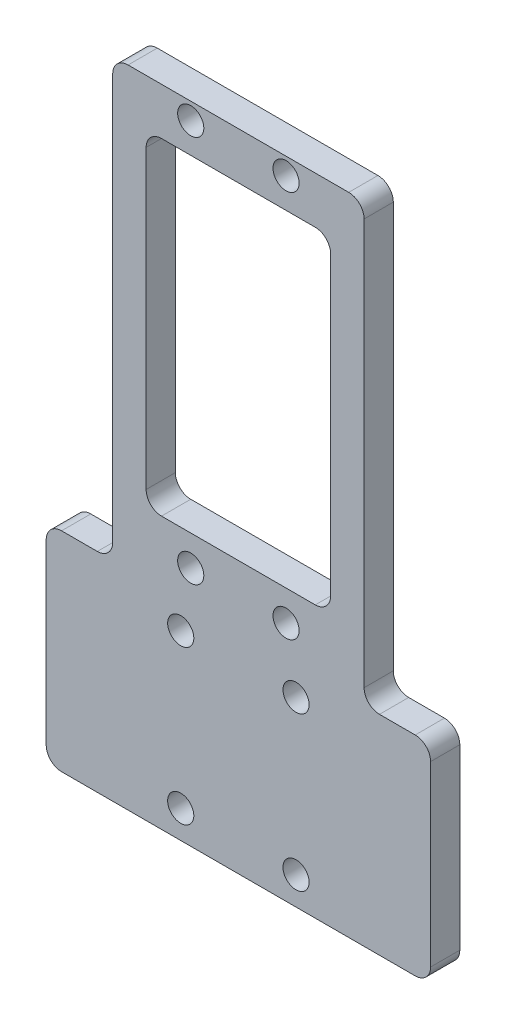
from build123d import *

# Parameters (mm, degrees)
SKETCH1_R           = 1.7
BOSS_EXTRUDE1_DEPTH = 3.8


with BuildPart() as part:
    # Sketch1 → Boss-Extrude1 (new body)
    with BuildSketch(Plane.XY):
        with BuildLine():
            Line((3.000019473, 70.3), (31.700019473, 70.3))
            ThreePointArc((31.700019473, 70.3), (33.114233035, 69.714213562), (33.700019473, 68.3))
            Line((33.700019473, 68.3), (33.700019473, 15.5))
            ThreePointArc((33.700019473, 15.5), (34.285805911, 14.085786438), (35.700019473, 13.5))
            Line((35.700019473, 13.5), (40.350019473, 13.5))
            ThreePointArc((40.350019473, 13.5), (41.764233035, 12.914213562), (42.350019473, 11.5))
            Line((42.350019473, 11.5), (42.350019473, -11.641128199))
            ThreePointArc((42.350019473, -11.641128199), (41.764233035, -13.055341761), (40.350019473, -13.641128199))
            Line((40.350019473, -13.641128199), (31.700019473, -13.641128199))
            Line((31.700019473, -13.641128199), (3.000019473, -13.641128199))
            Line((3.000019473, -13.641128199), (-5.649980527, -13.641128199))
            ThreePointArc((-5.649980527, -13.641128199), (-7.064194089, -13.055341761), (-7.649980527, -11.641128199))
            Line((-7.649980527, -11.641128199), (-7.649980527, 11.5))
            ThreePointArc((-7.649980527, 11.5), (-7.064194089, 12.914213562), (-5.649980527, 13.5))
            Line((-5.649980527, 13.5), (-0.999980527, 13.5))
            ThreePointArc((-0.999980527, 13.5), (0.414233035, 14.085786438), (1.000019473, 15.5))
            Line((1.000019473, 15.5), (1.000019473, 68.3))
            ThreePointArc((1.000019473, 68.3), (1.585805911, 69.714213562), (3.000019473, 70.3))
        make_face()
        with Locations(Location((11.15, 17.7, 0), (0, 0, 180))):
            Circle(SKETCH1_R, mode=Mode.SUBTRACT)
        with Locations(Location((9.85, 10, 0), (0, 0, 180))):
            Circle(SKETCH1_R, mode=Mode.SUBTRACT)
        with Locations(Location((24.85, 10, 0), (0, 0, 180))):
            Circle(SKETCH1_R, mode=Mode.SUBTRACT)
        with Locations(Location((9.85, -10, 0), (0, 0, 180))):
            Circle(SKETCH1_R, mode=Mode.SUBTRACT)
        with Locations(Location((24.85, -10, 0), (0, 0, 180))):
            Circle(SKETCH1_R, mode=Mode.SUBTRACT)
        with Locations(Location((23.55, 17.7, 0), (0, 0, 180))):
            Circle(SKETCH1_R, mode=Mode.SUBTRACT)
        with Locations(Location((23.55, 68.1, 0), (0, 0, 180))):
            Circle(SKETCH1_R, mode=Mode.SUBTRACT)
        with Locations(Location((11.15, 68.1, 0), (0, 0, 180))):
            Circle(SKETCH1_R, mode=Mode.SUBTRACT)
        with BuildLine():
            Line((7.35, 64.190811085), (27.35, 64.190811085))
            ThreePointArc((27.35, 64.190811085), (28.764213562, 63.605024648), (29.35, 62.190811085))
            Line((29.35, 62.190811085), (29.35, 23.654008347))
            ThreePointArc((29.35, 23.654008347), (28.764213562, 22.239794784), (27.35, 21.654008347))
            Line((27.35, 21.654008347), (7.35, 21.654008347))
            ThreePointArc((7.35, 21.654008347), (5.935786438, 22.239794784), (5.35, 23.654008347))
            Line((5.35, 23.654008347), (5.35, 62.190811085))
            ThreePointArc((5.35, 62.190811085), (5.935786438, 63.605024648), (7.35, 64.190811085))
        make_face(mode=Mode.SUBTRACT)
    extrude(amount=BOSS_EXTRUDE1_DEPTH)


solid = part.part
